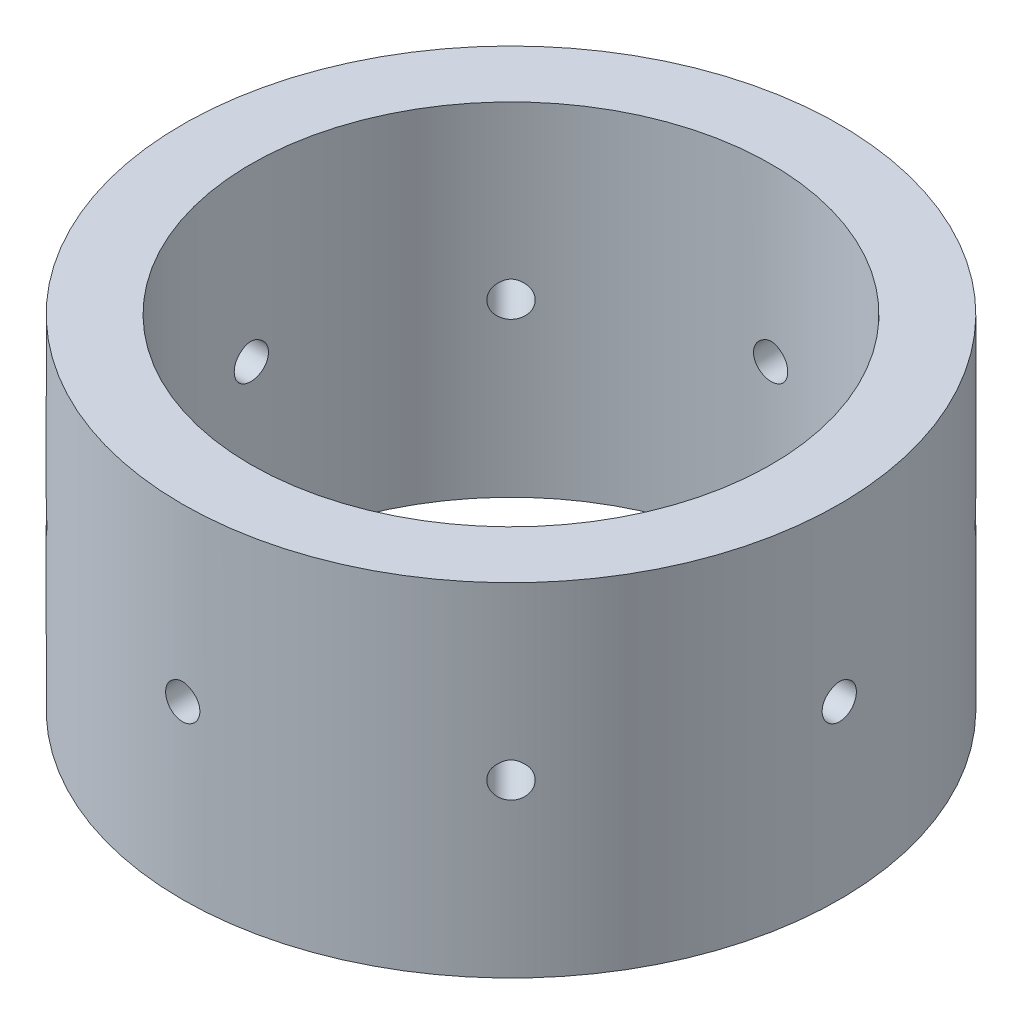
from build123d import *

# Parameters (mm, degrees)
SKETCH3_R               = 48
SKETCH3_R_2             = 38
BOSS_EXTRUDE1_DEPTH     = 50
CUT_EXTRUDE1_REACH      = 120.406
CUT_EXTRUDE1_END_RADIUS = 38
CIRPATTERN1_COUNT       = 8


with BuildPart() as part:
    # Sketch3 → Boss-Extrude1 (new body)
    with BuildSketch(Plane(origin=(0, 0, 0), x_dir=(1, 0, 0), z_dir=(0, 1, 0))):
        with Locations(Location((0, 0, 0), (0, 0, 270))):
            Circle(SKETCH3_R)
        with Locations(Location((0, 0, 0), (0, 0, 270))):
            Circle(SKETCH3_R_2, mode=Mode.SUBTRACT)
    extrude(amount=BOSS_EXTRUDE1_DEPTH)

    # Cut-Extrude1: up to this cylinder (the profile starts outside it)
    cut_extrude1_end = Plane(origin=(0, 25.016674, 0), z_dir=(0, -1, 0)) * Cylinder(CUT_EXTRUDE1_END_RADIUS, 317.812, mode=Mode.PRIVATE)
    # Sketch5 → Cut-Extrude1 (cut, up to the surface)
    with BuildSketch(Plane(origin=(48, 0, 0), x_dir=(0, 0, -1), z_dir=(1, 0, 0)), mode=Mode.PRIVATE) as cut_extrude1_sk1:
        with BuildLine():
            ThreePointArc((-1.25, 27.165063509), (0, 22.5), (1.25, 27.165063509))
            add(Edge.make_bspline(
                [(1.25, 27.165063509), (0, 28.00437214), (-1.25, 27.165063509)],
                knots=[0, 0, 0, 1, 1, 1], degree=2))
        make_face()
    cut_extrude1_tool1 = extrude(cut_extrude1_sk1.sketch, amount=-CUT_EXTRUDE1_REACH, mode=Mode.PRIVATE) - cut_extrude1_end
    cut_extrude1 = cut_extrude1_tool1.solids().sort_by_distance((48, 25.016674, 0))[0]
    add(cut_extrude1, mode=Mode.SUBTRACT)

    # CirPattern1: Cut-Extrude1 ×8 about axis
    cirpattern1_axis = Axis((0, 50, 0), (0, -1, 0))
    for i in range(1, CIRPATTERN1_COUNT):
        add(cut_extrude1.rotate(cirpattern1_axis, i * 360 / CIRPATTERN1_COUNT), mode=Mode.SUBTRACT)


solid = part.part
